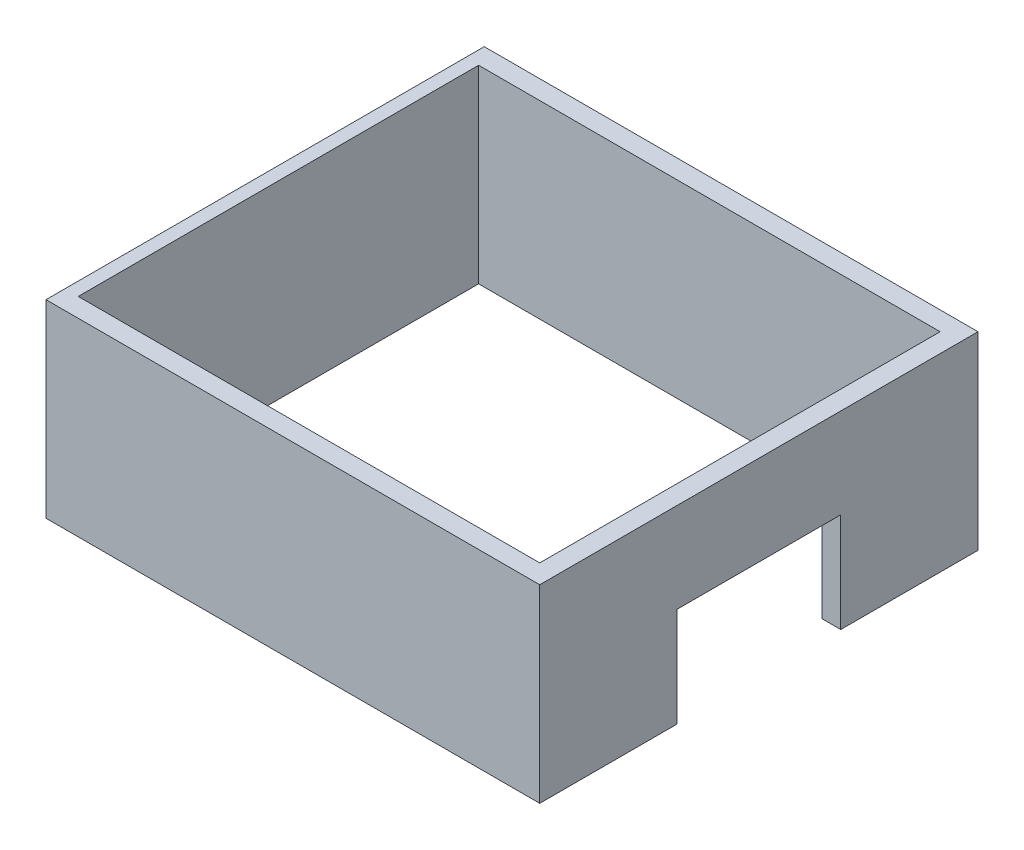
from build123d import *

# Parameters (mm, degrees)
CROQUIS1_W              = 52.162291224
CROQUIS1_H              = 46.3
CROQUIS1_W_2            = 48.758168483
CROQUIS1_H_2            = 42.3
SALIENTE_EXTRUIR1_DEPTH = 20
CROQUIS2_W              = 17.3
CROQUIS2_H              = 10.5
CORTAR_EXTRUIR1_DEPTH   = 20


with BuildPart() as part:
    # Croquis1 → Saliente-Extruir1 (new body)
    with BuildSketch(Plane(origin=(0, 0, 0), x_dir=(1, 0, 0), z_dir=(0, 1, 0))):
        with Locations((-2.82198106, 0)):
            Rectangle(CROQUIS1_W, CROQUIS1_H)
        with Locations((-3.119919689, 0)):
            Rectangle(CROQUIS1_W_2, CROQUIS1_H_2, mode=Mode.SUBTRACT)
    extrude(amount=SALIENTE_EXTRUIR1_DEPTH)

    # Croquis2 → Cortar-Extruir1 (cut)
    with BuildSketch(Plane(origin=(23.259164552, 0, 0), x_dir=(0, 0, -1), z_dir=(1, 0, 0))):
        with Locations((0, 5.25)):
            Rectangle(CROQUIS2_W, CROQUIS2_H)
    extrude(amount=-CORTAR_EXTRUIR1_DEPTH, mode=Mode.SUBTRACT)


solid = part.part
